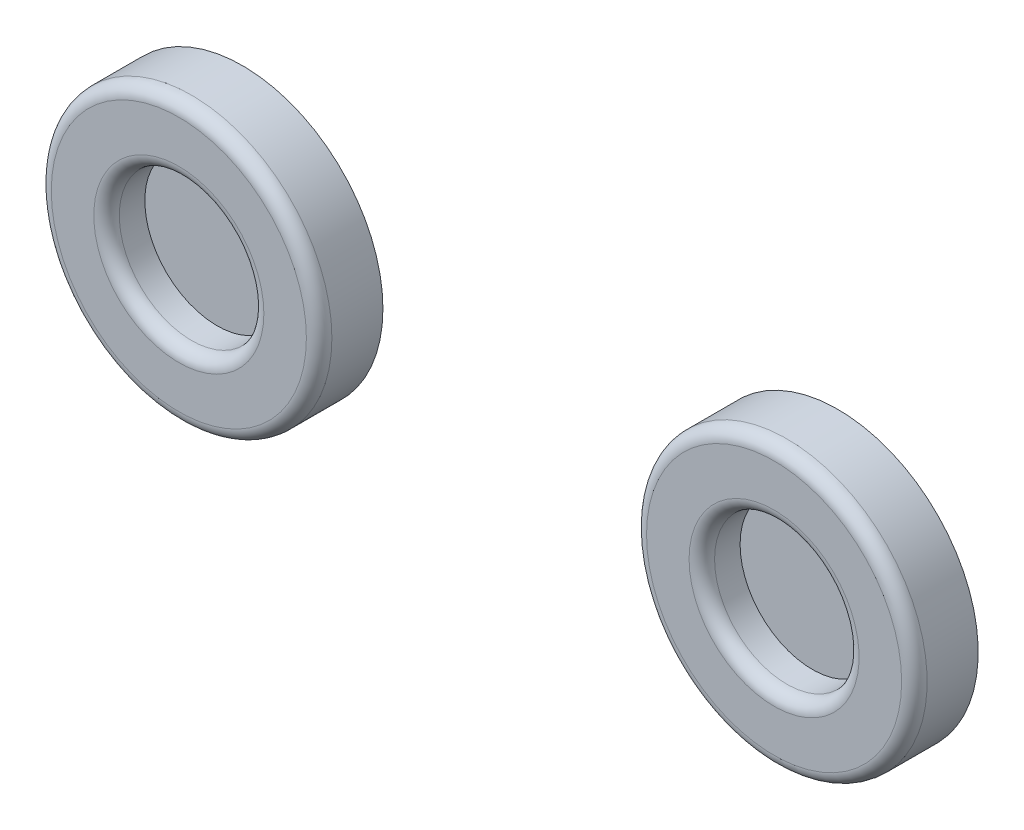
from build123d import *

# Parameters (mm, degrees)
SKETCH1_R             = 33
BOSS_EXTRUDE1_DEPTH   = 15
BOSS_EXTRUDE1_2_DEPTH = 15
SKETCH2_R             = 17
CUT_EXTRUDE1_DEPTH    = 9
FILLET1_R             = 3
FILLET2_R             = 3
FILLET3_R             = 3
FILLET4_R             = 3


with BuildPart() as part:
    # Sketch1 → Boss-Extrude1 (new body)
    with BuildSketch(Plane.XY):
        with Locations((-70, 0)):
            Circle(SKETCH1_R)
    extrude(amount=BOSS_EXTRUDE1_DEPTH)


with BuildPart() as body_2:
    # Sketch1 → Boss-Extrude1 2 (new body)
    with BuildSketch(Plane.XY):
        with Locations(Location((70, 0, 0), (0, 0, 180))):
            Circle(SKETCH1_R)
    extrude(amount=BOSS_EXTRUDE1_2_DEPTH)


with BuildPart() as cut_extrude1_tool:
    # Sketch2 → Cut-Extrude1 (new body)
    with BuildSketch(Plane.XY.offset(15)):
        with Locations((-70, 0)):
            Circle(SKETCH2_R)
        with Locations(Location((70, 0, 0), (0, 0, 180))):
            Circle(SKETCH2_R)
    extrude(amount=-CUT_EXTRUDE1_DEPTH)


with BuildPart() as part_1:
    add(part.part)

    # Cut-Extrude1: cut by cut_extrude1_tool
    add(cut_extrude1_tool.part, mode=Mode.SUBTRACT)

    # Fillet1
    fillet1_edges = [part_1.edges().sort_by_distance(p)[0] for p in [
        (-103, 0, 15),
    ]]
    fillet(fillet1_edges, radius=FILLET1_R)

    # Fillet4
    fillet4_edges = [part_1.edges().sort_by_distance(p)[0] for p in [
        (-87, 0, 15),
    ]]
    fillet(fillet4_edges, radius=FILLET4_R)


with BuildPart() as body_2_1:
    add(body_2.part)

    # Cut-Extrude1: cut by cut_extrude1_tool
    add(cut_extrude1_tool.part, mode=Mode.SUBTRACT)

    # Fillet2
    fillet2_edges = [body_2_1.edges().sort_by_distance(p)[0] for p in [
        (103, 0, 15),
    ]]
    fillet(fillet2_edges, radius=FILLET2_R)

    # Fillet3
    fillet3_edges = [body_2_1.edges().sort_by_distance(p)[0] for p in [
        (87, 0, 15),
    ]]
    fillet(fillet3_edges, radius=FILLET3_R)


solid = Compound([part_1.part, body_2_1.part])
